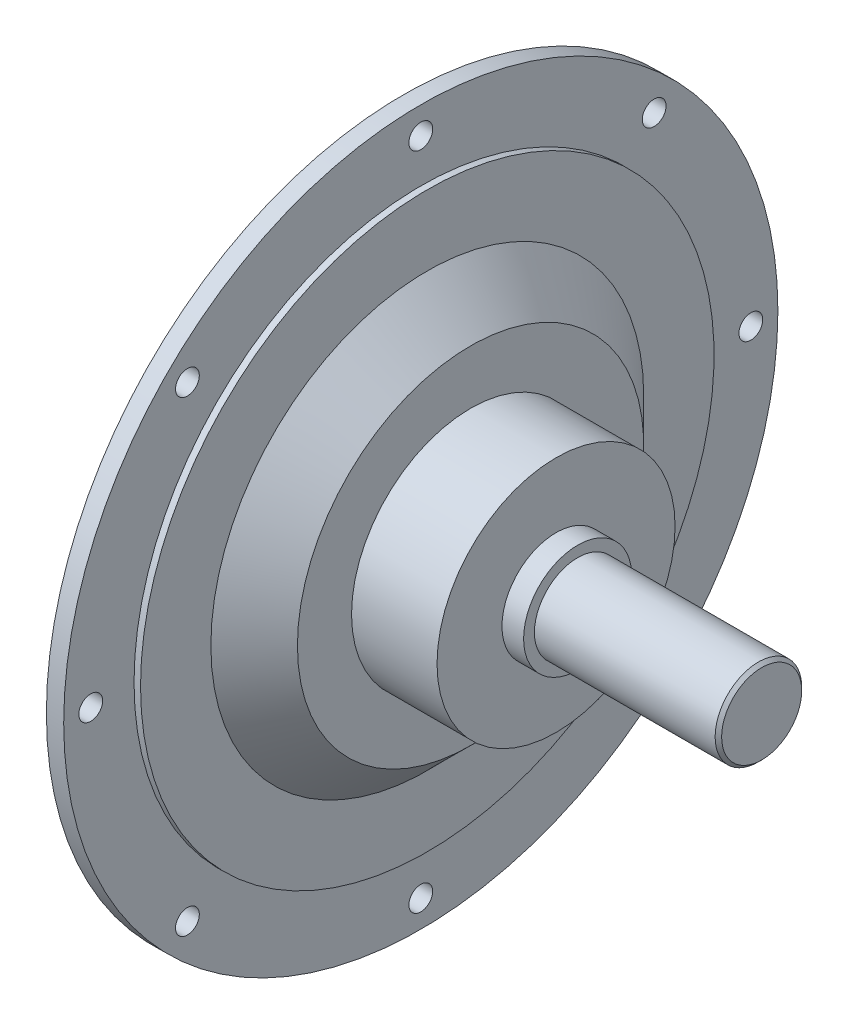
from build123d import *

# Parameters (mm, degrees)
FASE1_SIZE                = 1.5
DURCHGANGSLOCH_F_R_M101_D = 11
KREISMUSTER1_COUNT        = 8


with BuildPart() as part:
    # Skizze3 → Rotation1 (revolve)
    with BuildSketch(Plane.XY, mode=Mode.PRIVATE) as rotation1_sk:
        Polygon((0, 132.5), (0, 165), (-8, 165), (-8, 95.443650814), (12, 75.443650814), (12, 68.933358006), (-40, 55), (-40, 0), (157.5, 0), (157.5, 20), (72.5, 20), (72.5, 25), (62.5, 25), (62.5, 55), (23, 55), (23, 80), (3, 100), (3, 132.5), align=None)
    revolve(rotation1_sk.sketch.rotate(Axis((-57.654973763, 0, 0), (1, 0, 0)), 90), axis=Axis((-57.654973763, 0, 0), (1, 0, 0)))

    # Fase1
    fase1_edges = [part.edges().sort_by_distance(p)[0] for p in [
        (157.5, 0, -20),
    ]]
    chamfer(fase1_edges, length=FASE1_SIZE)

    # Durchgangsloch für M101 (through all)
    with Locations(Plane(origin=(0, 0, 0), x_dir=(0, 0, -1), z_dir=(1, 0, 0))):
        with Locations((0, 152.5)):
            durchgangsloch_f_r_m101 = Hole(DURCHGANGSLOCH_F_R_M101_D / 2)

    # Kreismuster1: Durchgangsloch für M101 ×8 about axis
    kreismuster1_axis = Axis((0, 0, 0), (1, 0, 0))
    for i in range(1, KREISMUSTER1_COUNT):
        add(durchgangsloch_f_r_m101.rotate(kreismuster1_axis, i * 360 / KREISMUSTER1_COUNT), mode=Mode.SUBTRACT)


solid = part.part
